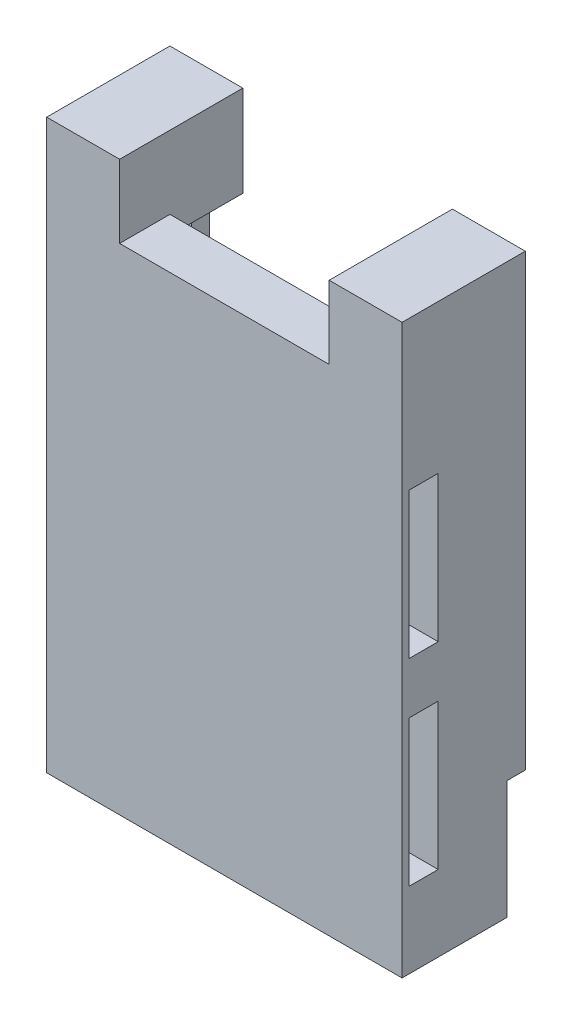
from build123d import *

# Parameters (mm, degrees)
BOSS_EXTRUDE1_DEPTH = 83.0326
SKETCH6_W           = 61.8998
SKETCH6_H           = 21.463
BOSS_EXTRUDE3_DEPTH = 3.175
SKETCH7_W           = 16.5354
SKETCH7_H           = 9.525
CUT_EXTRUDE2_DEPTH  = 91.420129415
SKETCH8_W           = 5.08
SKETCH8_H           = 25.4
CUT_EXTRUDE3_DEPTH  = 108.64212172
SKETCH15_W          = 61.8998
SKETCH15_H          = 20.63242
CUT_EXTRUDE4_DEPTH  = 3.175
SKETCH16_W          = 36.4998
SKETCH16_H          = 12.7
CUT_EXTRUDE5_DEPTH  = 3.175
SKETCH17_W          = 12.7
SKETCH17_H          = 21.463
BOSS_EXTRUDE4_DEPTH = 12.7


with BuildPart() as part:
    # Sketch1 → Boss-Extrude1 (new body)
    with BuildSketch(Plane(origin=(0, 0, 0), x_dir=(1, 0, 0), z_dir=(0, 1, 0))):
        Polygon((-30.9499, -3.477149156), (30.9499, -3.477149156), (30.9499, 17.985850844), (24.0411, 17.985850844), (24.0411, 14.810850844), (27.7749, 14.810850844), (27.7749, 5.285850844), (-27.7749, 5.285850844), (-27.7749, 14.810850844), (-24.0411, 14.810850844), (-24.0411, 17.985850844), (-30.9499, 17.985850844), align=None)
    extrude(amount=BOSS_EXTRUDE1_DEPTH)

    # Sketch6 → Boss-Extrude3 (add)
    with BuildSketch(Plane(origin=(0, 83.0326, 0), x_dir=(1, 0, 0), z_dir=(0, 1, 0))):
        with Locations((0, 7.254350844)):
            Rectangle(SKETCH6_W, SKETCH6_H)
    extrude(amount=BOSS_EXTRUDE3_DEPTH)

    # Sketch7 → Cut-Extrude2 (cut, through all)
    with BuildSketch(Plane.XZ.offset(-83.0326)):
        with Locations((0, -10.048350844)):
            Rectangle(SKETCH7_W, SKETCH7_H)
    extrude(amount=-CUT_EXTRUDE2_DEPTH, mode=Mode.SUBTRACT)

    # Sketch8 → Cut-Extrude3 (cut, through all)
    with BuildSketch(Plane.ZY.offset(30.9499)):
        with Locations((-0.274453158, 60.28364576)):
            Rectangle(SKETCH8_W, SKETCH8_H)
        with Locations((-0.274453158, 25.92395424)):
            Rectangle(SKETCH8_W, SKETCH8_H)
    extrude(amount=-CUT_EXTRUDE3_DEPTH, mode=Mode.SUBTRACT)

    # Sketch15 → Cut-Extrude4 (cut)
    with BuildSketch(Plane(origin=(0, 0, -17.985850844), x_dir=(-1, 0, 0), z_dir=(0, 0, -1))):
        with Locations((0, 10.31621)):
            Rectangle(SKETCH15_W, SKETCH15_H)
    extrude(amount=-CUT_EXTRUDE4_DEPTH, mode=Mode.SUBTRACT)

    # Sketch16 → Cut-Extrude5 (cut)
    with BuildSketch(Plane(origin=(0, 86.2076, 0), x_dir=(1, 0, 0), z_dir=(0, 1, 0))):
        with Locations((0, 11.635850844)):
            Rectangle(SKETCH16_W, SKETCH16_H)
    extrude(amount=-CUT_EXTRUDE5_DEPTH, mode=Mode.SUBTRACT)

    # Sketch17 → Boss-Extrude4 (add)
    with BuildSketch(Plane(origin=(0, 86.2076, 0), x_dir=(1, 0, 0), z_dir=(0, 1, 0))):
        with Locations((-24.5999, 7.254350844)):
            Rectangle(SKETCH17_W, SKETCH17_H)
        with Locations((24.5999, 7.254350844)):
            Rectangle(SKETCH17_W, SKETCH17_H)
    extrude(amount=BOSS_EXTRUDE4_DEPTH)


solid = part.part
